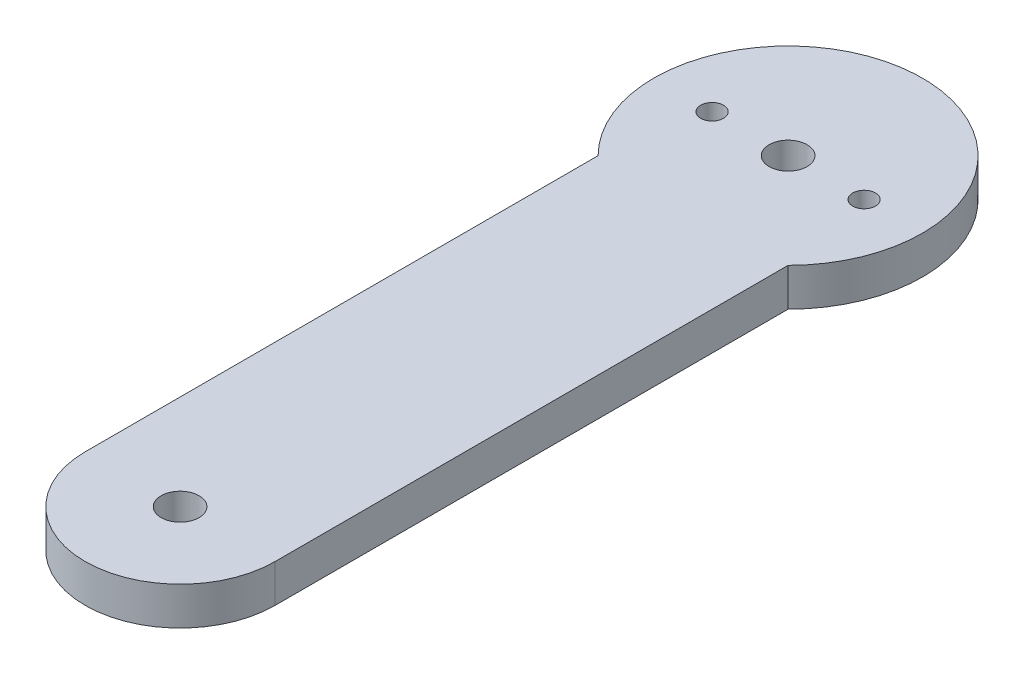
from build123d import *

# Parameters (mm, degrees)
SKETCH1_R           = 2.5
SKETCH1_R_2         = 1.5
BOSS_EXTRUDE1_DEPTH = 5


with BuildPart() as part:
    # Sketch1 → Boss-Extrude1 (new body)
    with BuildSketch(Plane(origin=(0, 0, 0), x_dir=(1, 0, 0), z_dir=(0, 1, 0))):
        with BuildLine():
            Line((-12.5, 67.5), (-12.5, 0))
            ThreePointArc((-12.5, 0), (0, -12.5), (12.5, 0))
            Line((12.5, 0), (12.5, 67.5))
            ThreePointArc((12.5, 67.5), (0, 97.67766953), (-12.5, 67.5))
        make_face()
        with Locations(Location((0, 0, 0), (0, 0, 270))):
            Circle(SKETCH1_R, mode=Mode.SUBTRACT)
        with Locations(Location((0, 80, 0), (0, 0, 270))):
            Circle(SKETCH1_R, mode=Mode.SUBTRACT)
        with Locations(Location((10, 80, 0), (0, 0, 270))):
            Circle(SKETCH1_R_2, mode=Mode.SUBTRACT)
        with Locations(Location((-10, 80, 0), (0, 0, 90))):
            Circle(SKETCH1_R_2, mode=Mode.SUBTRACT)
    extrude(amount=BOSS_EXTRUDE1_DEPTH)


solid = part.part
